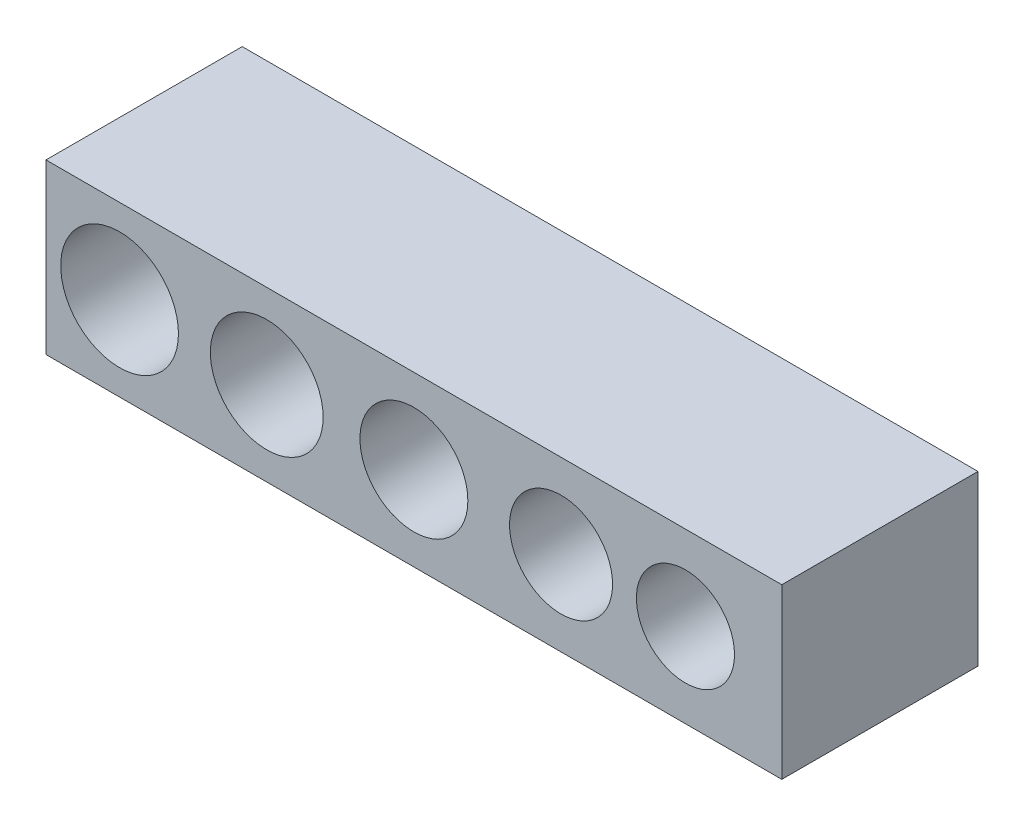
from build123d import *

# Parameters (mm, degrees)
SKETCH1_W           = 15
SKETCH1_H           = 3.437195072
SKETCH1_R           = 1.2
SKETCH1_R_2         = 1
SKETCH1_R_3         = 1.05
SKETCH1_R_4         = 1.15
SKETCH1_R_5         = 1.1
BOSS_EXTRUDE1_DEPTH = 4


with BuildPart() as part:
    # Sketch1 → Boss-Extrude1 (new body)
    with BuildSketch(Plane.XY):
        Rectangle(SKETCH1_W, SKETCH1_H)
        with Locations((-6, 0)):
            Circle(SKETCH1_R, mode=Mode.SUBTRACT)
        with Locations((5.536057004, 0)):
            Circle(SKETCH1_R_2, mode=Mode.SUBTRACT)
        with Locations((3, 0)):
            Circle(SKETCH1_R_3, mode=Mode.SUBTRACT)
        with Locations((-3, 0)):
            Circle(SKETCH1_R_4, mode=Mode.SUBTRACT)
        Circle(SKETCH1_R_5, mode=Mode.SUBTRACT)
    extrude(amount=BOSS_EXTRUDE1_DEPTH)


solid = part.part
